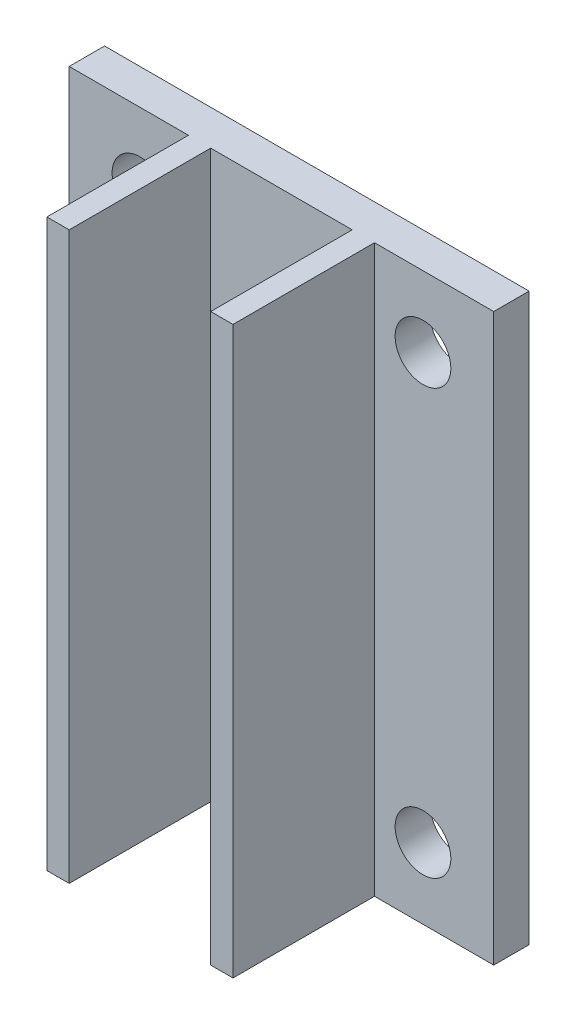
from build123d import *

# Parameters (mm, degrees)
BOSS_EXTRUDE1_DEPTH = 101.6
SKETCH2_R           = 5
CUT_EXTRUDE1_DEPTH  = 114.058535724


with BuildPart() as part:
    # Sketch1 → Boss-Extrude1 (new body)
    with BuildSketch(Plane(origin=(0, 0, 0), x_dir=(1, 0, 0), z_dir=(0, 1, 0))):
        Polygon((-12.7, 0), (12.7, 0), (12.7, -25.4), (16.7, -25.4), (16.7, 0), (38.1, 0), (38.1, 6.35), (-38.1, 6.35), (-38.1, 0), (-16.7, 0), (-16.7, -25.4), (-12.7, -25.4), align=None)
    extrude(amount=BOSS_EXTRUDE1_DEPTH)

    # Sketch2 → Cut-Extrude1 (cut, through all)
    with BuildSketch(Plane(origin=(0, 0, -6.35), x_dir=(-1, 0, 0), z_dir=(0, 0, -1))):
        with Locations((-25.4, 88.9)):
            Circle(SKETCH2_R)
        with Locations((25.4, 88.9)):
            Circle(SKETCH2_R)
        with Locations((-25.4, 12.7)):
            Circle(SKETCH2_R)
        with Locations((25.4, 12.7)):
            Circle(SKETCH2_R)
    extrude(amount=-CUT_EXTRUDE1_DEPTH, mode=Mode.SUBTRACT)


solid = part.part
